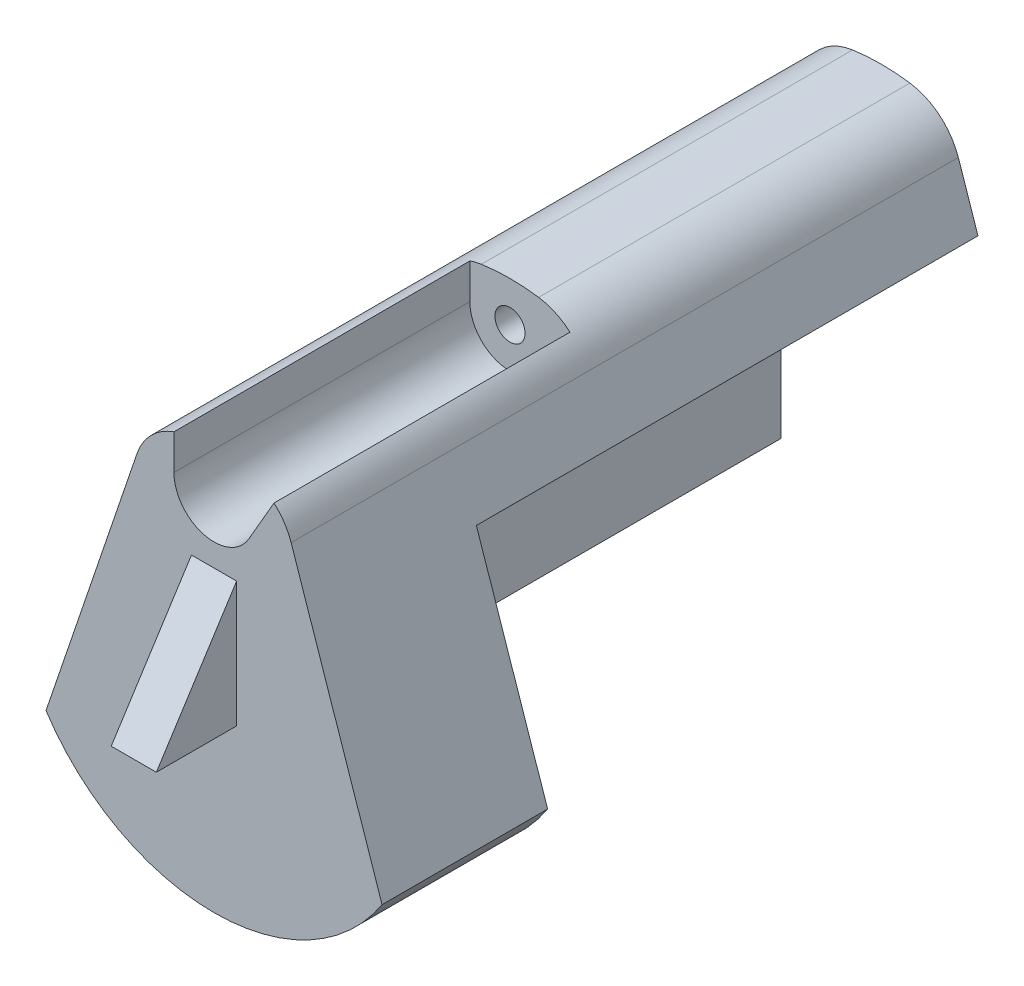
from build123d import *

# Parameters (mm, degrees)
SKETCH_1_R               = 1.5
EXTRUDE_1_DEPTH          = 66.5
CUT_EXTRUDE_1_DEPTH      = 72.43397301
CUT_EXTRUDE_1_DEPTH_BACK = 29.5
CUT_EXTRUDE_2_DEPTH      = 50
SKETCH_1_4_R             = 8.25
CUT_EXTRUDE_3_DEPTH      = 60
EXTRUDE_2_DEPTH          = 2.25


with BuildPart() as part:
    # 草图1 → 凸台-拉伸1 (new body)
    with BuildSketch(Plane.XY):
        with BuildLine():
            Line((-7.681906247, 15.784996271), (-16.75, -10.928746497))
            ThreePointArc((-16.75, -10.928746497), (0, -20), (16.75, -10.928746497))
            Line((16.75, -10.928746497), (7.681906247, 15.784996271))
            ThreePointArc((7.681906247, 15.784996271), (5.835532469, 18.470596932), (2.857607815, 19.794799256))
            ThreePointArc((2.857607815, 19.794799256), (0, 20), (-2.857607815, 19.794799256))
            ThreePointArc((-2.857607815, 19.794799256), (-5.835532469, 18.470596932), (-7.681906247, 15.784996271))
        make_face()
        with Locations((0, 16)):
            Circle(SKETCH_1_R, mode=Mode.SUBTRACT)
    extrude(amount=EXTRUDE_1_DEPTH)

    # 草图2 → 切除-拉伸1 (cut, two sides: drawn at the far end of the back side and taken through both)
    with BuildSketch(Plane.XY.offset(66.5).offset(-CUT_EXTRUDE_1_DEPTH_BACK)):
        with BuildLine():
            Line((3.464101615, 14), (5.975770193, 18.350337589))
            ThreePointArc((5.975770193, 18.350337589), (4.522314785, 19.300583014), (2.857607815, 19.794799256))
            ThreePointArc((2.857607815, 19.794799256), (0, 20), (-2.857607815, 19.794799256))
            ThreePointArc((-2.857607815, 19.794799256), (-3.435719859, 19.682133501), (-4, 19.513328789))
            Line((-4, 19.513328789), (-4, 16))
            ThreePointArc((-4, 16), (-1.03527618, 12.136296695), (3.464101615, 14))
        make_face()
    extrude(amount=CUT_EXTRUDE_1_DEPTH + CUT_EXTRUDE_1_DEPTH_BACK, mode=Mode.SUBTRACT)

    # 草图1<3> → 切除-拉伸2 (cut)
    with BuildSketch(Plane.XY):
        with BuildLine():
            Line((-10, 0), (-10, -17.320508076))
            ThreePointArc((-10, -17.320508076), (4.648040342, -19.452396279), (16.75, -10.928746497))
            Line((16.75, -10.928746497), (9.645647869, 10))
            Line((9.645647869, 10), (0, 10))
            ThreePointArc((0, 10), (-7.071067812, 7.071067812), (-10, 0))
        make_face()
    extrude(amount=CUT_EXTRUDE_2_DEPTH, mode=Mode.SUBTRACT)

    # 草图1<4> → 切除-拉伸3 (cut)
    with BuildSketch(Plane.XY):
        Circle(SKETCH_1_4_R)
    extrude(amount=CUT_EXTRUDE_3_DEPTH, mode=Mode.SUBTRACT)

    # 草图3 → 凸台-拉伸2 (add, symmetric)
    with BuildSketch(Plane(origin=(0, 0, 0), x_dir=(0, 0, -1), z_dir=(1, 0, 0))):
        Polygon((-66.5, 9.75), (-66.5, -2.75), (-74.5, -2.75), align=None)
    extrude(amount=EXTRUDE_2_DEPTH, both=True)


solid = part.part
